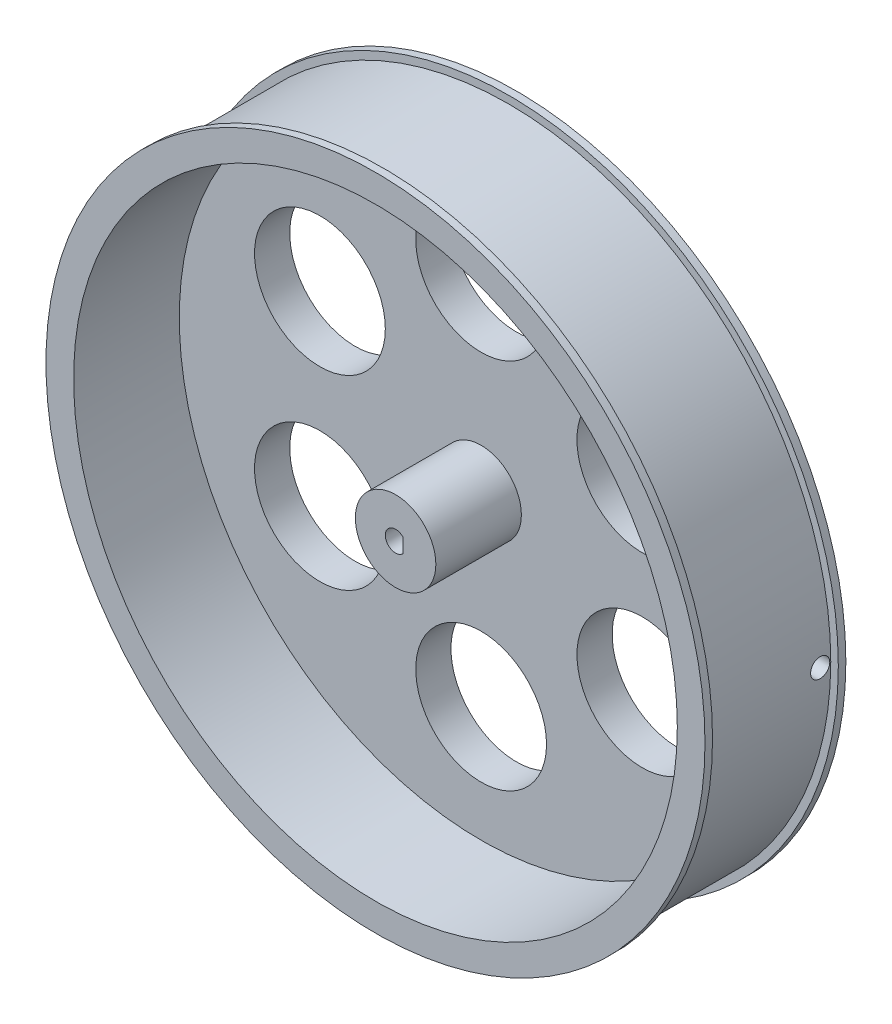
from build123d import *

# Parameters (mm, degrees)
SKETCH1_R              = 64
SKETCH1_R_2            = 60
RIM_DEPTH              = 28
SKETCH2_R              = 65.5
SKETCH2_R_2            = 63
INNER_BEAD_LIP_DEPTH   = 1.5
SKETCH3_R              = 65.5
SKETCH3_R_2            = 63
OUTER_BEAD_LIP_DEPTH   = 1.5
SKETCH4_R              = 61
WEB_DEPTH              = 7
SKETCH5_R              = 8
HUB_BOSS_DEPTH         = 24
SKETCH6_R              = 13
LIGHTENING_HOLES_DEPTH = 9
D_BORE_4MM_DEPTH       = 30
SKETCH8_R              = 1.3
GRUB_SCREW_M3_DEPTH    = 9
SKETCH9_R              = 1.9
GRUB_KEY_ACCESS_DEPTH  = 57.5


with BuildPart() as part:
    # Sketch1 → Rim (new body)
    with BuildSketch(Plane.XY):
        Circle(SKETCH1_R)
        Circle(SKETCH1_R_2, mode=Mode.SUBTRACT)
    extrude(amount=RIM_DEPTH)

    # Sketch2 → Inner_bead_lip (add)
    with BuildSketch(Plane.XY):
        Circle(SKETCH2_R)
        Circle(SKETCH2_R_2, mode=Mode.SUBTRACT)
    extrude(amount=INNER_BEAD_LIP_DEPTH)

    # Sketch3 → Outer_bead_lip (add)
    with BuildSketch(Plane.XY.offset(26.5)):
        Circle(SKETCH3_R)
        Circle(SKETCH3_R_2, mode=Mode.SUBTRACT)
    extrude(amount=OUTER_BEAD_LIP_DEPTH)

    # Sketch4 → Web (add)
    with BuildSketch(Plane.XY):
        Circle(SKETCH4_R)
    extrude(amount=WEB_DEPTH)

    # Sketch5 → Hub_boss (add)
    with BuildSketch(Plane.XY):
        Circle(SKETCH5_R)
    extrude(amount=HUB_BOSS_DEPTH)

    # Sketch6 → Lightening_holes (cut)
    with BuildSketch(Plane.XY.offset(-1)):
        with Locations((32.04293994, 18.5)):
            Circle(SKETCH6_R)
        with Locations((0, 37)):
            Circle(SKETCH6_R)
        with Locations((-32.04293994, 18.5)):
            Circle(SKETCH6_R)
        with Locations((-32.04293994, -18.5)):
            Circle(SKETCH6_R)
        with Locations((0, -37)):
            Circle(SKETCH6_R)
        with Locations((32.04293994, -18.5)):
            Circle(SKETCH6_R)
    extrude(amount=LIGHTENING_HOLES_DEPTH, mode=Mode.SUBTRACT)

    # Sketch7 → D_bore_4mm (cut)
    with BuildSketch(Plane.XY.offset(-1)):
        with BuildLine():
            Line((1.5, -1.397318861), (1.5, 1.397318861))
            ThreePointArc((1.5, 1.397318861), (-2.05, 0), (1.5, -1.397318861))
        make_face()
    extrude(amount=D_BORE_4MM_DEPTH, mode=Mode.SUBTRACT)

    # Sketch8 → Grub_screw_M3 (cut)
    with BuildSketch(Plane(origin=(0, 0, 0), x_dir=(0, 0, -1), z_dir=(1, 0, 0))):
        with Locations(Location((-3.6, 0, 0), (0, 0, 270))):
            Circle(SKETCH8_R)
    extrude(amount=GRUB_SCREW_M3_DEPTH, mode=Mode.SUBTRACT)

    # Sketch9 → Grub_key_access (cut)
    with BuildSketch(Plane(origin=(8.5, 0, 0), x_dir=(0, 0, -1), z_dir=(1, 0, 0))):
        with Locations((-3.6, 0)):
            Circle(SKETCH9_R)
    extrude(amount=GRUB_KEY_ACCESS_DEPTH, mode=Mode.SUBTRACT)


solid = part.part
